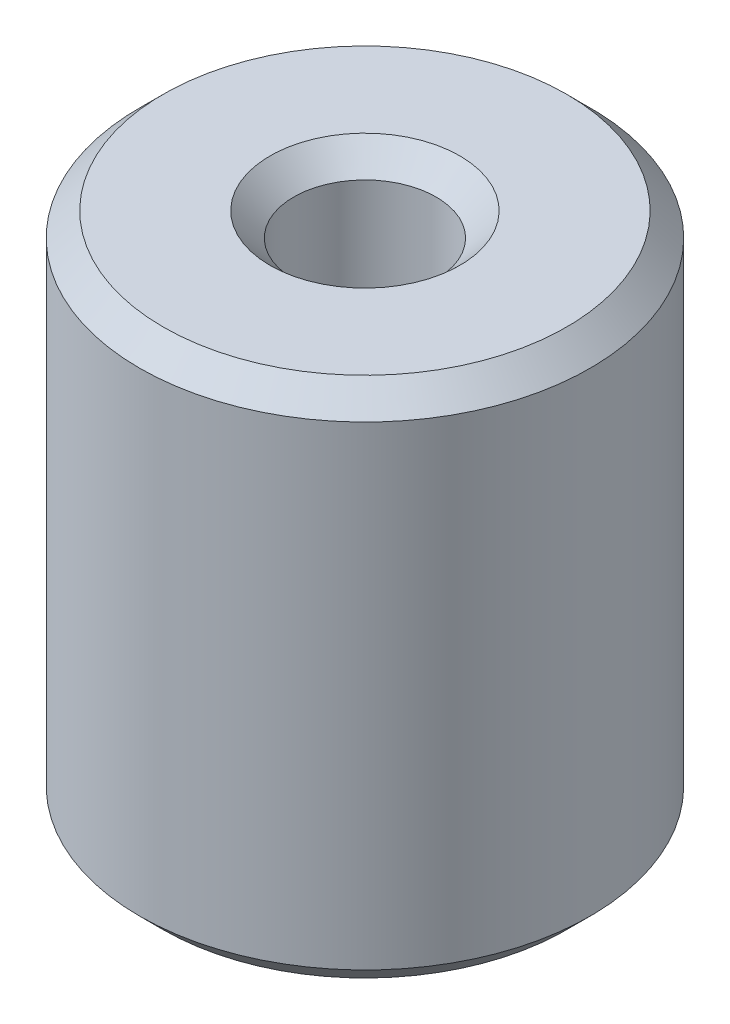
from build123d import *

# Parameters (mm, degrees)
SKETCH1_R           = 9.5
SKETCH1_R_2         = 3
BOSS_EXTRUDE1_DEPTH = 22
CHAMFER1_SIZE       = 1


with BuildPart() as part:
    # Sketch1 → Boss-Extrude1 (new body)
    with BuildSketch(Plane(origin=(0, 0, 0), x_dir=(1, 0, 0), z_dir=(0, 1, 0))):
        with Locations(Location((0, 0, 0), (0, 0, 270))):
            Circle(SKETCH1_R)
        with Locations(Location((0, 0, 0), (0, 0, 270))):
            Circle(SKETCH1_R_2, mode=Mode.SUBTRACT)
    extrude(amount=BOSS_EXTRUDE1_DEPTH)

    # Chamfer1
    chamfer1_edges = [part.edges().sort_by_distance(p)[0] for p in [
        (0, 0, -9.5),
        (0, 22, -9.5),
        (0, 0, -3),
        (0, 22, -3),
    ]]
    chamfer(chamfer1_edges, length=CHAMFER1_SIZE)


solid = part.part
